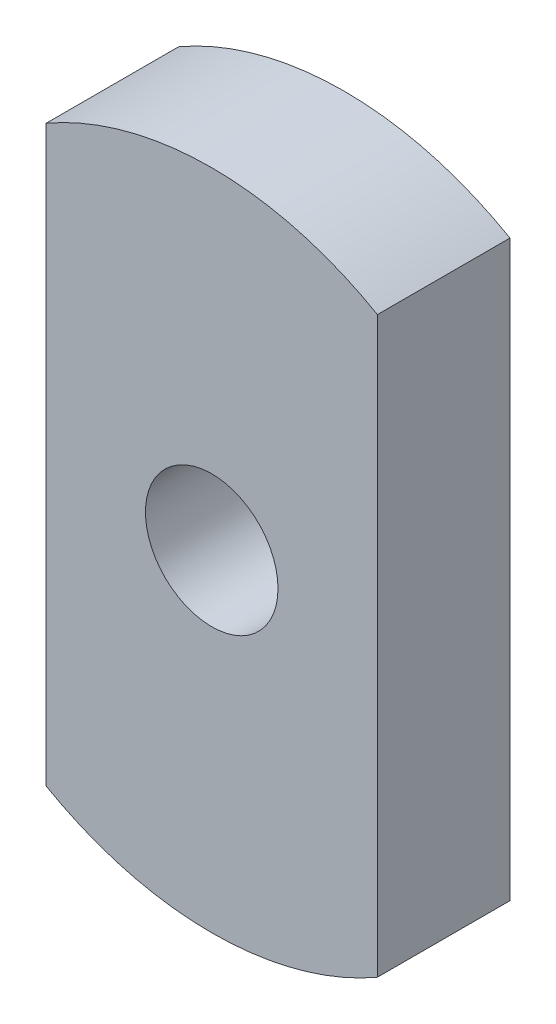
from build123d import *

# Parameters (mm, degrees)
SKETCH1_R           = 2
BOSS_EXTRUDE1_DEPTH = 4


with BuildPart() as part:
    # Sketch1 → Boss-Extrude1 (new body)
    with BuildSketch(Plane.XY):
        with BuildLine():
            Line((-5, 8.660254038), (-5, -8.660254038))
            ThreePointArc((-5, -8.660254038), (0, -10), (5, -8.660254038))
            Line((5, -8.660254038), (5, 8.660254038))
            ThreePointArc((5, 8.660254038), (0, 10), (-5, 8.660254038))
        make_face()
        Circle(SKETCH1_R, mode=Mode.SUBTRACT)
    extrude(amount=BOSS_EXTRUDE1_DEPTH)


solid = part.part
